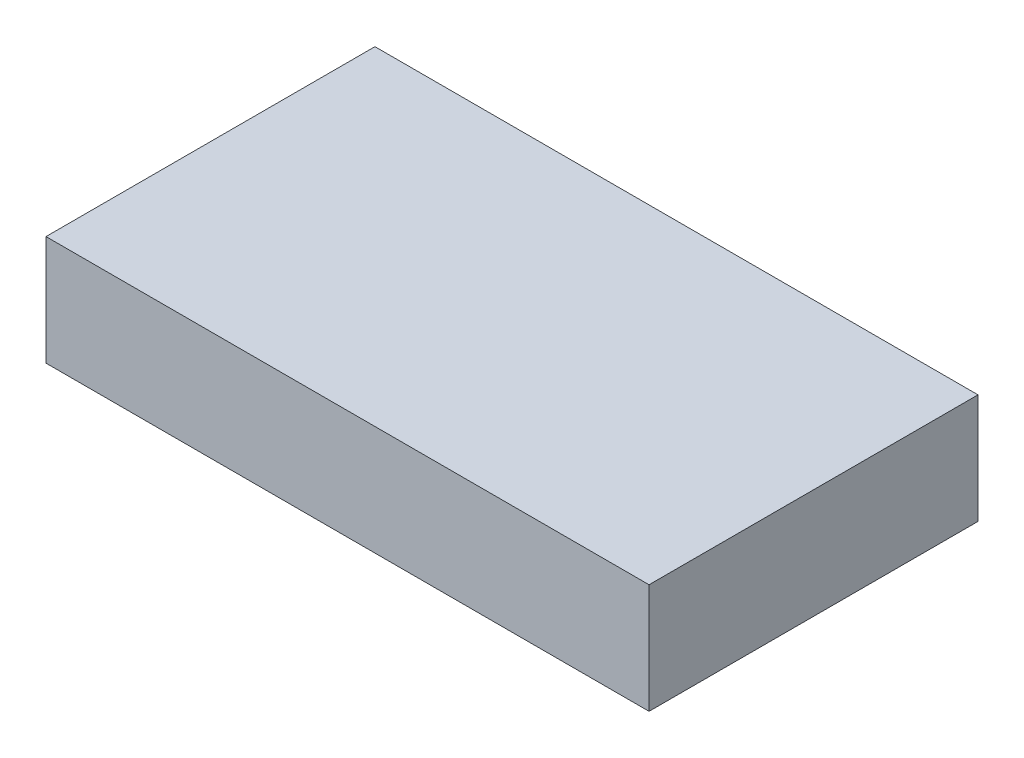
from build123d import *

# Parameters (mm, degrees)
SKETCH1_W           = 55.88
SKETCH1_H           = 30.48
BOSS_EXTRUDE1_DEPTH = 10.16


with BuildPart() as part:
    # Sketch1 → Boss-Extrude1 (new body)
    with BuildSketch(Plane(origin=(0, 0, 0), x_dir=(1, 0, 0), z_dir=(0, 1, 0))):
        with Locations((-27.94, 15.24)):
            Rectangle(SKETCH1_W, SKETCH1_H)
    extrude(amount=BOSS_EXTRUDE1_DEPTH)


solid = part.part
